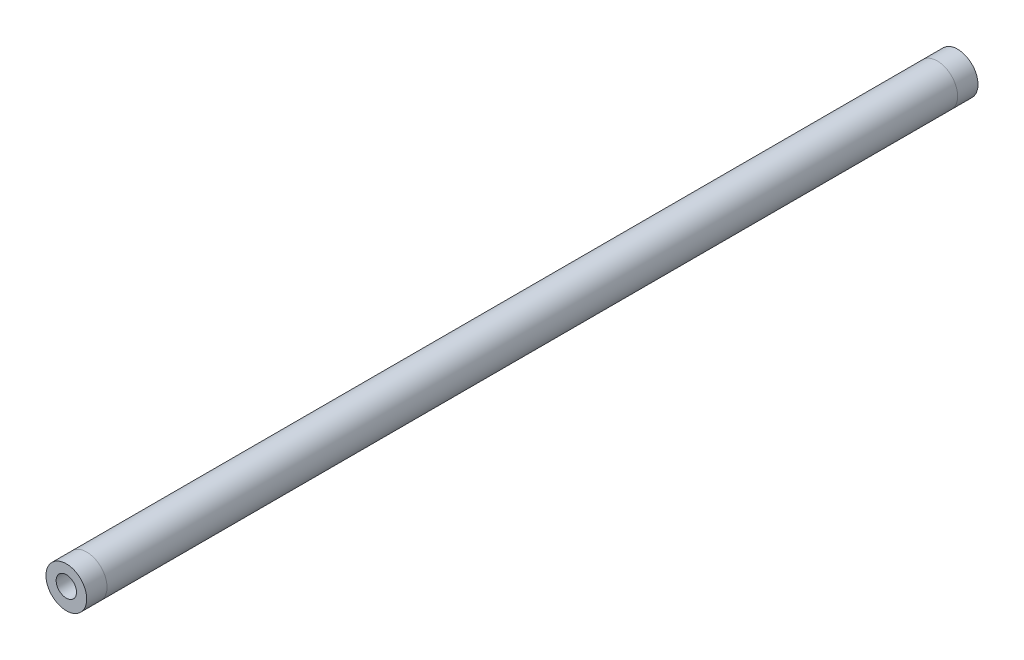
from build123d import *

# Parameters (mm, degrees)
THREADED_START            = -21.8948
SKETCH2_R                 = 6.35
SKETCH2_R_2               = 4.7625
SKETCH2_R_3               = 3.175
THREADED_INSERT_1_1_DEPTH = 6.35
THREADED_START_2          = -28.2448
SKETCH2_5_R               = 4.7625
SKETCH2_5_R_2             = 3.175
THREADED_INSERT_1_2_DEPTH = 9.525
BOSS_EXTRUDE4_START       = -299.863916
SKETCH2_7_R               = 6.35
SKETCH2_7_R_2             = 4.7625
SKETCH2_7_R_3             = 3.175
BOSS_EXTRUDE4_DEPTH       = 6.35
BOSS_EXTRUDE5_START       = -283.988916
SKETCH2_8_R               = 4.7625
SKETCH2_8_R_2             = 3.175
BOSS_EXTRUDE5_DEPTH       = 9.525
BOSS_EXTRUDE6_START       = -28.2448
SKETCH2_9_R               = 6.35
SKETCH2_9_R_2             = 4.7625
BOSS_EXTRUDE6_DEPTH       = 265.2691164


with BuildPart() as part:
    # Sketch2 → Threaded Insert 1-1 (new body)
    # profile 1 of 2: a face of its own
    with BuildSketch(Plane.XY.offset(THREADED_START)):
        Circle(SKETCH2_R)
        Circle(SKETCH2_R_2, mode=Mode.SUBTRACT)
    # profile 2 of 2: a face of its own
    with BuildSketch(Plane.XY.offset(THREADED_START)):
        Circle(SKETCH2_R_2)
        with Locations((0, 0.235008439)):
            Circle(SKETCH2_R_3, mode=Mode.SUBTRACT)
    extrude(amount=-THREADED_INSERT_1_1_DEPTH)

    # Sketch2<5> → Threaded Insert 1-2 (add)
    with BuildSketch(Plane.XY.offset(THREADED_START_2)):
        Circle(SKETCH2_5_R)
        with Locations((0, 0.235008439)):
            Circle(SKETCH2_5_R_2, mode=Mode.SUBTRACT)
    extrude(amount=-THREADED_INSERT_1_2_DEPTH)


with BuildPart() as body_2:
    # Sketch2<7> → Boss-Extrude4 (new body)
    # profile 1 of 2: a face of its own
    with BuildSketch(Plane.XY.offset(BOSS_EXTRUDE4_START)):
        Circle(SKETCH2_7_R)
        Circle(SKETCH2_7_R_2, mode=Mode.SUBTRACT)
    # profile 2 of 2: a face of its own
    with BuildSketch(Plane.XY.offset(BOSS_EXTRUDE4_START)):
        Circle(SKETCH2_7_R_2)
        with Locations((0, 0.235008439)):
            Circle(SKETCH2_7_R_3, mode=Mode.SUBTRACT)
    extrude(amount=BOSS_EXTRUDE4_DEPTH)

    # Sketch2<8> → Boss-Extrude5 (add)
    with BuildSketch(Plane.XY.offset(BOSS_EXTRUDE5_START)):
        with Locations(Location((0, 0, 0), (0, 0, 180))):
            Circle(SKETCH2_8_R)
        with Locations((0, 0.235008439)):
            Circle(SKETCH2_8_R_2, mode=Mode.SUBTRACT)
    extrude(amount=-BOSS_EXTRUDE5_DEPTH)


with BuildPart() as body_3:
    # Sketch2<9> → Boss-Extrude6 (new body)
    with BuildSketch(Plane.XY.offset(BOSS_EXTRUDE6_START)):
        Circle(SKETCH2_9_R)
        Circle(SKETCH2_9_R_2, mode=Mode.SUBTRACT)
    extrude(amount=-BOSS_EXTRUDE6_DEPTH)


solid = Compound([part.part, body_2.part, body_3.part])
